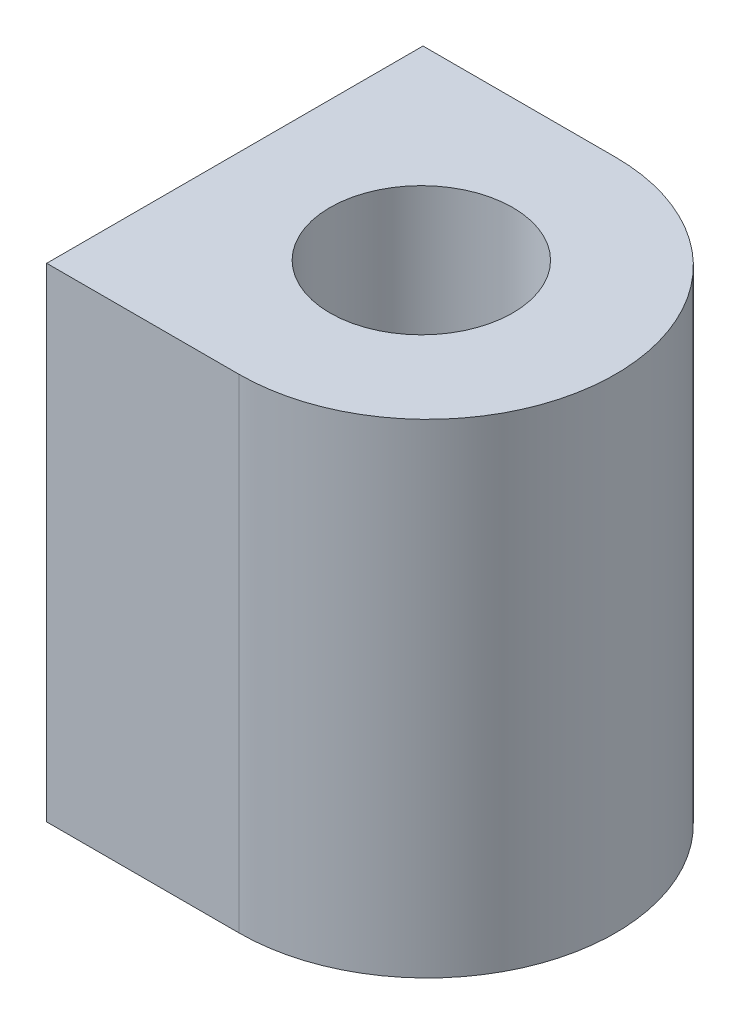
from build123d import *

# Parameters (mm, degrees)
SKETCH1_R           = 1.7
BOSS_EXTRUDE2_DEPTH = 9


with BuildPart() as part:
    # Sketch1 → Boss-Extrude2 (new body)
    with BuildSketch(Plane(origin=(0, 0, 0), x_dir=(1, 0, 0), z_dir=(0, 1, 0))):
        with BuildLine():
            Line((-3.435794878, -0.033363683), (-3.435794878, 3.466636317))
            Line((-3.435794878, 3.466636317), (0.143666226, 3.466636317))
            ThreePointArc((0.143666226, 3.466636317), (3.643666226, -0.033363683), (0.143666226, -3.533363683))
            Line((0.143666226, -3.533363683), (-3.435794878, -3.533363683))
            Line((-3.435794878, -3.533363683), (-3.435794878, -0.033363683))
        make_face()
        with Locations(Location((0, 0, 0), (0, 0, 270))):
            Circle(SKETCH1_R, mode=Mode.SUBTRACT)
    extrude(amount=BOSS_EXTRUDE2_DEPTH)


solid = part.part
